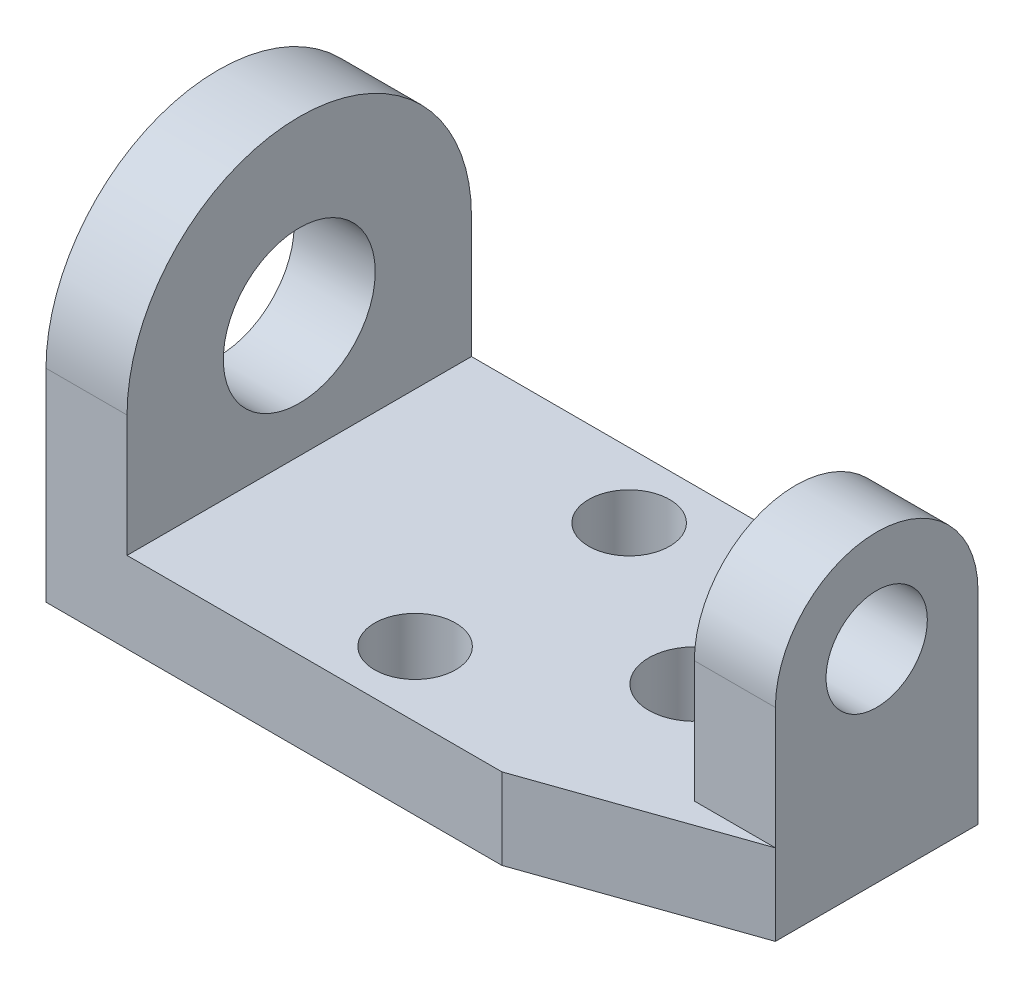
from build123d import *

# Parameters (mm, degrees)
SKETCH1_R           = 4
SKETCH1_R_2         = 4.5
SKETCH1_W           = 8
SKETCH1_H           = 34
SKETCH1_H_2         = 20
BOSS_EXTRUDE1_DEPTH = 8
SKETCH1_4_W         = 8
SKETCH1_4_H         = 34
BOSS_EXTRUDE2_DEPTH = 37
SKETCH1_5_W         = 8
SKETCH1_5_H         = 20
BOSS_EXTRUDE3_DEPTH = 30
SKETCH4_R           = 5
CUT_EXTRUDE1_DEPTH  = 8
SKETCH5_R           = 7.5
CUT_EXTRUDE2_DEPTH  = 71.049982156


with BuildPart() as part:
    # Sketch1 → Boss-Extrude1 (new body)
    # profile 1 of 3: a face of its own
    with BuildSketch(Plane(origin=(0, 0, 0), x_dir=(1, 0, 0), z_dir=(0, 1, 0))):
        Polygon((8, 17), (8, -17), (45, -17), (65, -10), (57, -10), (57, 10), (65, 10), (45, 17), align=None)
        with Locations(Location((30, -10.563020066, 0), (0, 0, 270))):
            Circle(SKETCH1_R, mode=Mode.SUBTRACT)
        with Locations(Location((30, 10.563020066, 0), (0, 0, 270))):
            Circle(SKETCH1_R, mode=Mode.SUBTRACT)
        with Locations(Location((47, 0, 0), (0, 0, 270))):
            Circle(SKETCH1_R_2, mode=Mode.SUBTRACT)
    # profile 2 of 3: a face of its own
    with BuildSketch(Plane(origin=(0, 0, 0), x_dir=(1, 0, 0), z_dir=(0, 1, 0))):
        with Locations((4, 0)):
            Rectangle(SKETCH1_W, SKETCH1_H)
    # profile 3 of 3: a face of its own
    with BuildSketch(Plane(origin=(0, 0, 0), x_dir=(1, 0, 0), z_dir=(0, 1, 0))):
        with Locations((61, 0)):
            Rectangle(SKETCH1_W, SKETCH1_H_2)
    extrude(amount=BOSS_EXTRUDE1_DEPTH)

    # Sketch1<4> → Boss-Extrude2 (add)
    with BuildSketch(Plane(origin=(0, 0, 0), x_dir=(1, 0, 0), z_dir=(0, 1, 0))):
        with Locations((4, 0)):
            Rectangle(SKETCH1_4_W, SKETCH1_4_H)
    extrude(amount=BOSS_EXTRUDE2_DEPTH)

    # Sketch1<5> → Boss-Extrude3 (add)
    with BuildSketch(Plane(origin=(0, 0, 0), x_dir=(1, 0, 0), z_dir=(0, 1, 0))):
        with Locations((61, 0)):
            Rectangle(SKETCH1_5_W, SKETCH1_5_H)
    extrude(amount=BOSS_EXTRUDE3_DEPTH)

    # Sketch4 → Cut-Extrude1 (cut)
    with BuildSketch(Plane(origin=(65, 0, 0), x_dir=(0, 0, -1), z_dir=(1, 0, 0))):
        with BuildLine():
            ThreePointArc((0, 30), (7.071067812, 27.071067812), (10, 20))
            Line((10, 20), (10, 30))
            Line((10, 30), (0, 30))
        make_face()
        with BuildLine():
            ThreePointArc((-10, 20), (-7.071067812, 27.071067812), (0, 30))
            Line((0, 30), (-10, 30))
            Line((-10, 30), (-10, 20))
        make_face()
        with Locations((0, 20)):
            Circle(SKETCH4_R)
    extrude(amount=-CUT_EXTRUDE1_DEPTH, mode=Mode.SUBTRACT)

    # Sketch5 → Cut-Extrude2 (cut, through all)
    with BuildSketch(Plane(origin=(8, 0, 0), x_dir=(0, 0, -1), z_dir=(1, 0, 0))):
        with BuildLine():
            ThreePointArc((-17, 20), (-12.02081528, 32.02081528), (0, 37))
            Line((0, 37), (-17, 37))
            Line((-17, 37), (-17, 20))
        make_face()
        with BuildLine():
            ThreePointArc((0, 37), (12.02081528, 32.02081528), (17, 20))
            Line((17, 20), (17, 37))
            Line((17, 37), (0, 37))
        make_face()
        with Locations((0, 20)):
            Circle(SKETCH5_R)
    extrude(amount=-CUT_EXTRUDE2_DEPTH, mode=Mode.SUBTRACT)


solid = part.part
